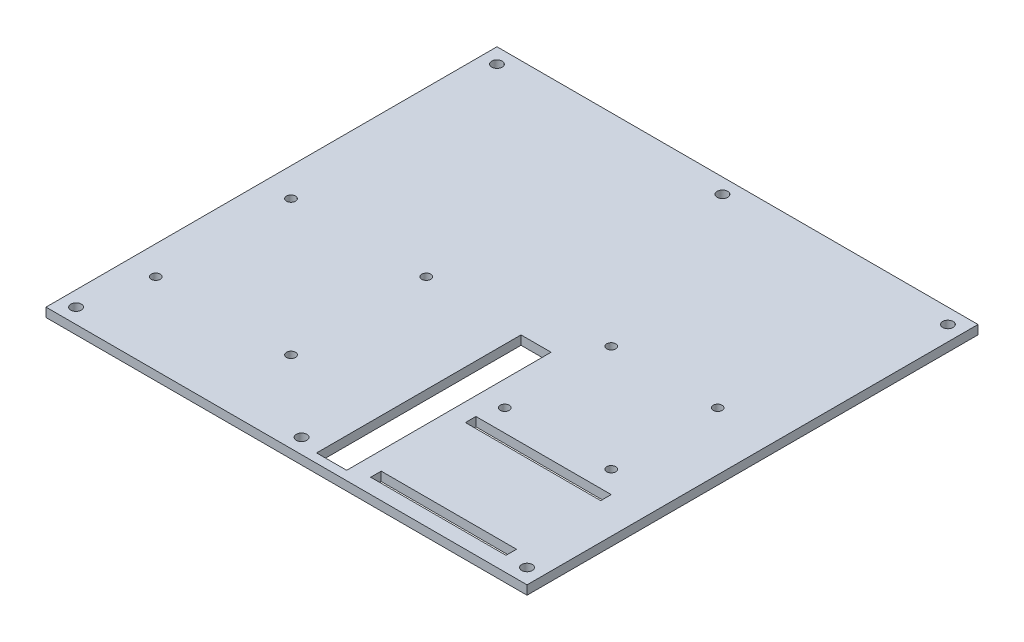
from build123d import *

# Parameters (mm, degrees)
SCHIZZO1_W                      = 160
SCHIZZO1_H                      = 150
BASE_DEPTH                      = 3
SCHIZZO2_W                      = 10
SCHIZZO2_H                      = 68
TAGLIOPMSINISTRA_DEPTH          = 110.69958979
SCHIZZO6_W                      = 45
SCHIZZO6_H                      = 3.5
FOROBECBASSO_DEPTH              = 110.69958979
SCHIZZO8_R                      = 1.5
FORIVITIPM_DEPTH                = 110.69958979
SCHIZZO9_R                      = 1.5
FORIVITICOMPANION_DEPTH         = 110.69958979
SCHIZZO12_R                     = 1.75
FORICOLLEGAMENTOFUSOLIERA_DEPTH = 110.69958979
SCHIZZO13_W                     = 10
SCHIZZO13_H                     = 68
CHIUSURATAGLIOSINISTROPM_DEPTH  = 3


with BuildPart() as part:
    # Schizzo1 → Base (new body)
    with BuildSketch(Plane(origin=(0, 0, 0), x_dir=(1, 0, 0), z_dir=(0, 1, 0))):
        Rectangle(SCHIZZO1_W, SCHIZZO1_H)
    extrude(amount=BASE_DEPTH)

    # Schizzo2 → TaglioPMSinistra (cut, through all)
    with BuildSketch(Plane(origin=(0, 3, 0), x_dir=(1, 0, 0), z_dir=(0, 1, 0))):
        with Locations((-58, -38)):
            Rectangle(SCHIZZO2_W, SCHIZZO2_H)
    tagliopmsinistra = extrude(amount=-TAGLIOPMSINISTRA_DEPTH, mode=Mode.SUBTRACT)

    # TaglioPMDestra: TaglioPMSinistra across plane
    add(tagliopmsinistra.mirror(Plane(origin=(-23, 0, 0), x_dir=(0, 0, 1), z_dir=(1, 0, 0))), mode=Mode.SUBTRACT)

    # Schizzo6 → ForoBECBasso (cut, through all)
    with BuildSketch(Plane(origin=(0, 3, 0), x_dir=(1, 0, 0), z_dir=(0, 1, 0))):
        with Locations((45.5, -68.25)):
            Rectangle(SCHIZZO6_W, SCHIZZO6_H)
    forobecbasso = extrude(amount=-FOROBECBASSO_DEPTH, mode=Mode.SUBTRACT)

    # ForoBECAlto: ForoBECBasso across plane
    add(forobecbasso.mirror(Plane.XY.offset(52.5)), mode=Mode.SUBTRACT)

    # Schizzo8 → ForiVitiPM (cut, through all)
    with BuildSketch(Plane(origin=(0, 3, 0), x_dir=(1, 0, 0), z_dir=(0, 1, 0))):
        with Locations(Location((-70.5, -3, 0), (0, 0, 270))):
            Circle(SCHIZZO8_R)
        with Locations(Location((-70.5, -48, 0), (0, 0, 270))):
            Circle(SCHIZZO8_R)
        with Locations(Location((-25.5, -48, 0), (0, 0, 90))):
            Circle(SCHIZZO8_R)
        with Locations(Location((-25.5, -3, 0), (0, 0, 90))):
            Circle(SCHIZZO8_R)
    extrude(amount=-FORIVITIPM_DEPTH, mode=Mode.SUBTRACT)

    # Schizzo9 → ForiVitiCompanion (cut, through all)
    with BuildSketch(Plane(origin=(0, 3, 0), x_dir=(1, 0, 0), z_dir=(0, 1, 0))):
        with Locations(Location((60.7, -27.7, 0), (0, 0, 270))):
            Circle(SCHIZZO9_R)
        with Locations(Location((25.3, -27.7, 0), (0, 0, 270))):
            Circle(SCHIZZO9_R)
        with Locations(Location((25.3, 7.7, 0), (0, 0, 270))):
            Circle(SCHIZZO9_R)
        with Locations(Location((60.7, 7.7, 0), (0, 0, 270))):
            Circle(SCHIZZO9_R)
    extrude(amount=-FORIVITICOMPANION_DEPTH, mode=Mode.SUBTRACT)

    # Schizzo12 → ForiCollegamentoFusoliera (cut, through all)
    with BuildSketch(Plane(origin=(0, 3, 0), x_dir=(1, 0, 0), z_dir=(0, 1, 0))):
        with Locations(Location((-75, 70, 0), (0, 0, 270))):
            Circle(SCHIZZO12_R)
        with Locations(Location((75, 70, 0), (0, 0, 270))):
            Circle(SCHIZZO12_R)
        with Locations(Location((0, 70, 0), (0, 0, 270))):
            Circle(SCHIZZO12_R)
        with Locations(Location((-75, -70, 0), (0, 0, 270))):
            Circle(SCHIZZO12_R)
        with Locations(Location((0, -70, 0), (0, 0, 270))):
            Circle(SCHIZZO12_R)
        with Locations(Location((75, -70, 0), (0, 0, 270))):
            Circle(SCHIZZO12_R)
    extrude(amount=-FORICOLLEGAMENTOFUSOLIERA_DEPTH, mode=Mode.SUBTRACT)

    # Schizzo13 → ChiusuraTaglioSinistroPM (add, through all)
    with BuildSketch(Plane(origin=(0, 3, 0), x_dir=(1, 0, 0), z_dir=(0, 1, 0))):
        with Locations((-58, -38)):
            Rectangle(SCHIZZO13_W, SCHIZZO13_H)
    extrude(amount=-CHIUSURATAGLIOSINISTROPM_DEPTH)


solid = part.part
